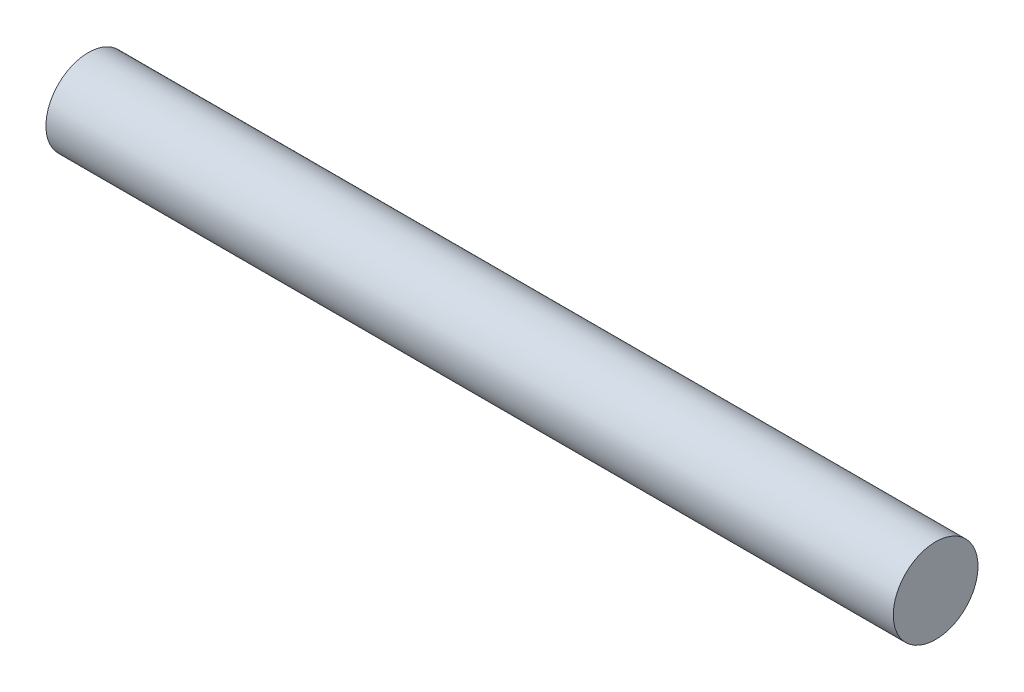
from build123d import *

# Parameters (mm, degrees)
SKETCH1_R           = 1
BOSS_EXTRUDE1_DEPTH = 20


with BuildPart() as part:
    # Sketch1 → Boss-Extrude1 (new body)
    with BuildSketch(Plane(origin=(0, 0, 0), x_dir=(0, 0, -1), z_dir=(1, 0, 0))):
        Circle(SKETCH1_R)
    extrude(amount=BOSS_EXTRUDE1_DEPTH)


solid = part.part
